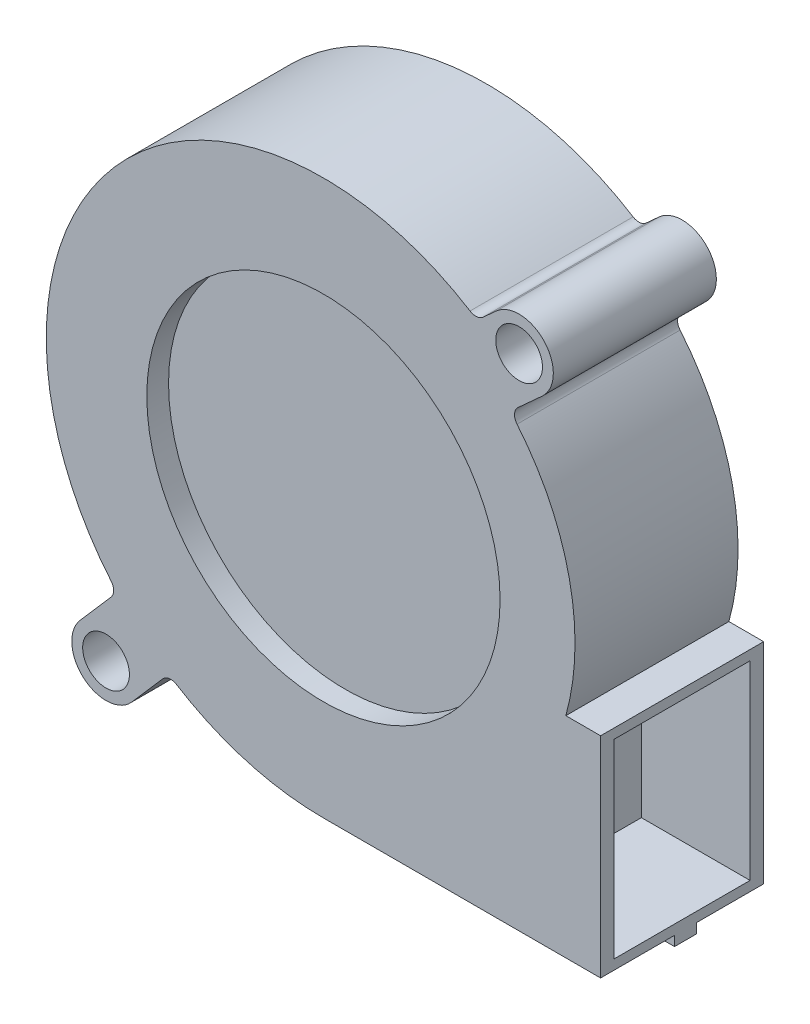
from build123d import *

# Parameters (mm, degrees)
SKETCH1_R           = 3.15
SKETCH1_R_2         = 2.15
BOSS_EXTRUDE1_DEPTH = 7.5
SKETCH3_W           = 2
SKETCH3_H           = 0.9
BOSS_EXTRUDE2_DEPTH = 11.4
SKETCH4_R           = 16.25
CUT_EXTRUDE1_DEPTH  = 2
SKETCH5_W           = 12.5
SKETCH5_H           = 17.5
CUT_EXTRUDE2_DEPTH  = 10


with BuildPart() as part:
    # Sketch1 → Boss-Extrude1 (new, symmetric)
    # profile 1 of 5: a face of its own
    with BuildSketch(Plane.XY):
        with BuildLine():
            ThreePointArc((-13.512663894, -21.625399753), (-7.028595389, -24.512218318), (0, -25.5))
            Line((0, -25.5), (0, -6.2))
            Line((0, -6.2), (22.3, -6.2))
            ThreePointArc((22.3, -6.2), (22.633696889, 4.842082728), (17.811452389, 14.781142168))
            ThreePointArc((17.811452389, 14.781142168), (17.583444291, 15.489857701), (17.908337826, 16.159715588))
            Line((17.908337826, 16.159715588), (18.928412767, 17.086988913))
            Line((18.928412767, 17.086988913), (20.118834813, 18.169111965))
            ThreePointArc((20.118834813, 18.169111965), (15.669111965, 18.381165187), (15.881165187, 22.830888035))
            Line((15.881165187, 22.830888035), (14.69074314, 21.748764984))
            ThreePointArc((14.69074314, 21.748764984), (14.108162444, 21.492793575), (13.489112369, 21.64009814))
            ThreePointArc((13.489112369, 21.64009814), (-19.251546311, 16.722080152), (-19.539541583, -16.384636545))
            ThreePointArc((-19.539541583, -16.384636545), (-19.305838355, -17.036142145), (-19.551192594, -17.683350027))
            Line((-19.551192594, -17.683350027), (-22.377007395, -20.933037048))
            ThreePointArc((-22.377007395, -20.933037048), (-18.896612782, -20.049570091), (-16.85, -23))
            ThreePointArc((-16.85, -23), (-17.049570091, -24.103387218), (-17.622992605, -25.066962952))
            Line((-17.622992605, -25.066962952), (-14.797177804, -21.817275931))
            ThreePointArc((-14.797177804, -21.817275931), (-14.190309608, -21.484428012), (-13.512663894, -21.625399753))
        make_face()
    # profile 2 of 5: a face of its own
    with BuildSketch(Plane.XY):
        with Locations((-20, -23)):
            Circle(SKETCH1_R)
        with Locations((-20, -23)):
            Circle(SKETCH1_R_2, mode=Mode.SUBTRACT)
    # profile 3 of 5: a face of its own
    with BuildSketch(Plane.XY):
        with Locations((18, 20.5)):
            Circle(SKETCH1_R)
        with Locations((18, 20.5)):
            Circle(SKETCH1_R_2, mode=Mode.SUBTRACT)
    # profile 4 of 5: a face of its own
    with BuildSketch(Plane.XY):
        with BuildLine():
            Line((0, -6.2), (0, -25.5))
            ThreePointArc((0, -25.5), (15.686777872, -20.104104059), (24.734793308, -6.2))
            Line((24.734793308, -6.2), (22.3, -6.2))
            Line((22.3, -6.2), (0, -6.2))
        make_face()
    # profile 5 of 5: a face of its own
    with BuildSketch(Plane.XY):
        with BuildLine():
            Line((0, -25.5), (25.5, -25.5))
            Line((25.5, -25.5), (25.5, -6.2))
            Line((25.5, -6.2), (24.734793308, -6.2))
            ThreePointArc((24.734793308, -6.2), (15.686777872, -20.104104059), (0, -25.5))
        make_face()
    extrude(amount=BOSS_EXTRUDE1_DEPTH, both=True)

    # Sketch3 → Boss-Extrude2 (add)
    with BuildSketch(Plane(origin=(25.5, 0, 0), x_dir=(0, 0, -1), z_dir=(1, 0, 0))):
        with Locations((0.3, -25.95)):
            Rectangle(SKETCH3_W, SKETCH3_H)
    extrude(amount=-BOSS_EXTRUDE2_DEPTH)

    # Sketch4 → Cut-Extrude1 (cut)
    with BuildSketch(Plane.XY.offset(7.5)):
        Circle(SKETCH4_R)
    extrude(amount=-CUT_EXTRUDE1_DEPTH, mode=Mode.SUBTRACT)

    # Sketch5 → Cut-Extrude2 (cut)
    with BuildSketch(Plane(origin=(25.5, 0, 0), x_dir=(0, 0, -1), z_dir=(1, 0, 0))):
        with Locations((0, -15.85)):
            Rectangle(SKETCH5_W, SKETCH5_H)
    extrude(amount=-CUT_EXTRUDE2_DEPTH, mode=Mode.SUBTRACT)


solid = part.part
